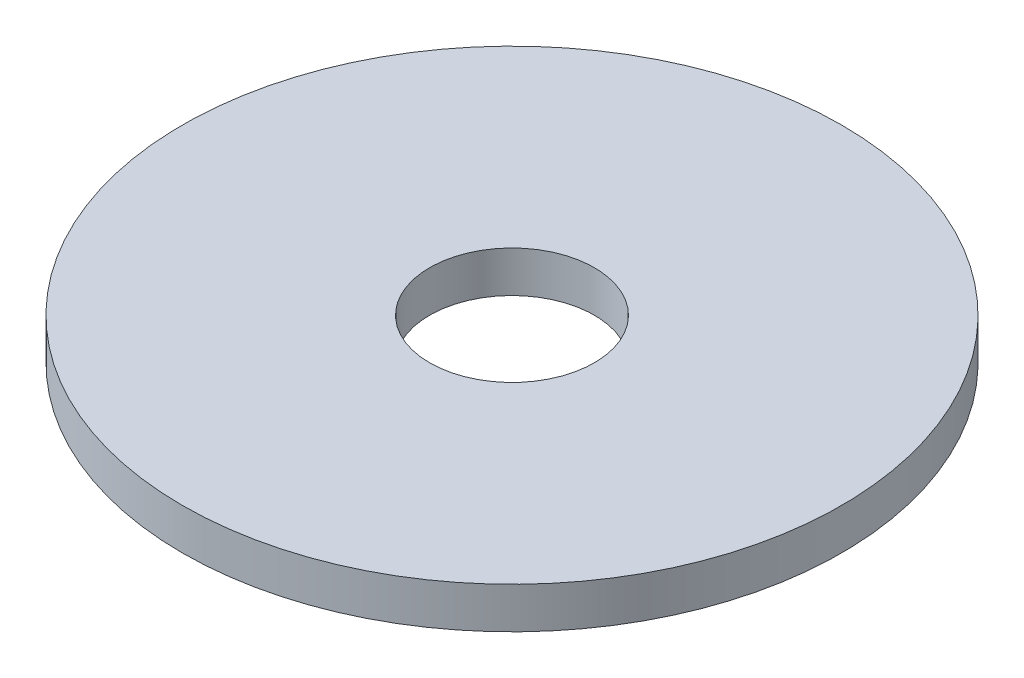
from build123d import *

# Parameters (mm, degrees)
SKETCH1_R           = 12.7
BOSS_EXTRUDE1_DEPTH = 1.5875
SKETCH2_R           = 3.175
CUT_EXTRUDE1_DEPTH  = 19.030533998


with BuildPart() as part:
    # Sketch1 → Boss-Extrude1 (new body)
    with BuildSketch(Plane(origin=(0, 0, 0), x_dir=(1, 0, 0), z_dir=(0, 1, 0))):
        with Locations(Location((0, 0, 0), (0, 0, 270))):
            Circle(SKETCH1_R)
    extrude(amount=BOSS_EXTRUDE1_DEPTH)

    # Sketch2 → Cut-Extrude1 (cut, through all)
    with BuildSketch(Plane(origin=(0, 1.5875, 0), x_dir=(1, 0, 0), z_dir=(0, 1, 0))):
        with Locations(Location((0, 0, 0), (0, 0, 270))):
            Circle(SKETCH2_R)
    extrude(amount=-CUT_EXTRUDE1_DEPTH, mode=Mode.SUBTRACT)


solid = part.part
